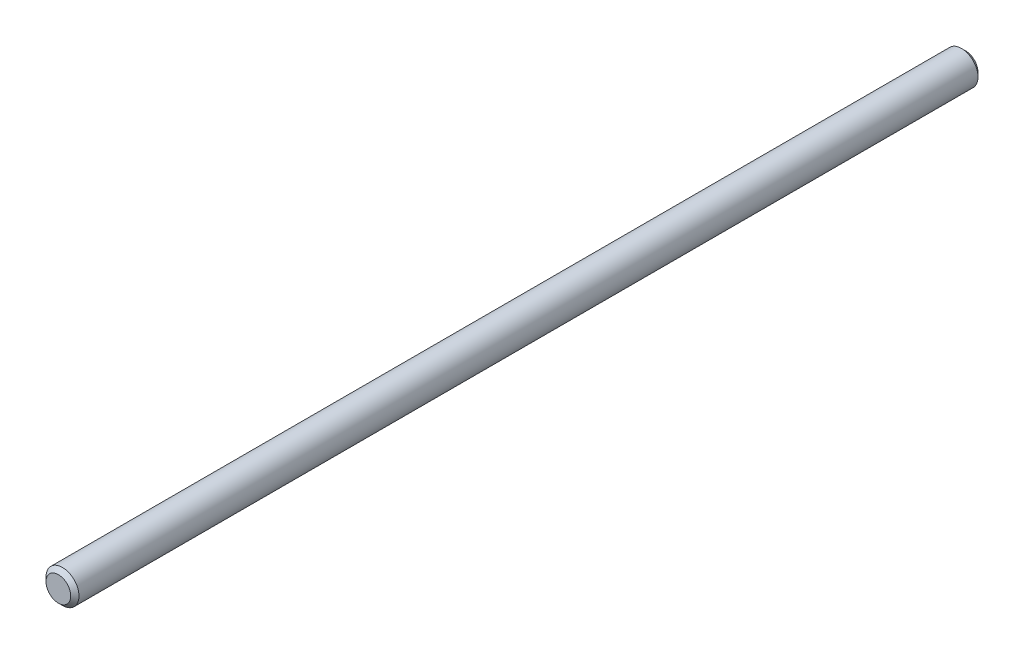
from build123d import *

# Parameters (mm, degrees)
SKETCH_1_R      = 2
EXTRUDE_1_DEPTH = 110
CHAMFER_1_SIZE  = 0.5


with BuildPart() as part:
    # 草图1 → 凸台-拉伸1 (new body)
    with BuildSketch(Plane.XY):
        Circle(SKETCH_1_R)
    extrude(amount=-EXTRUDE_1_DEPTH)

    # 倒角1
    chamfer_1_edges = [part.edges().sort_by_distance(p)[0] for p in [
        (-2, 0, 0),
        (-2, 0, -110),
    ]]
    chamfer(chamfer_1_edges, length=CHAMFER_1_SIZE)


solid = part.part
